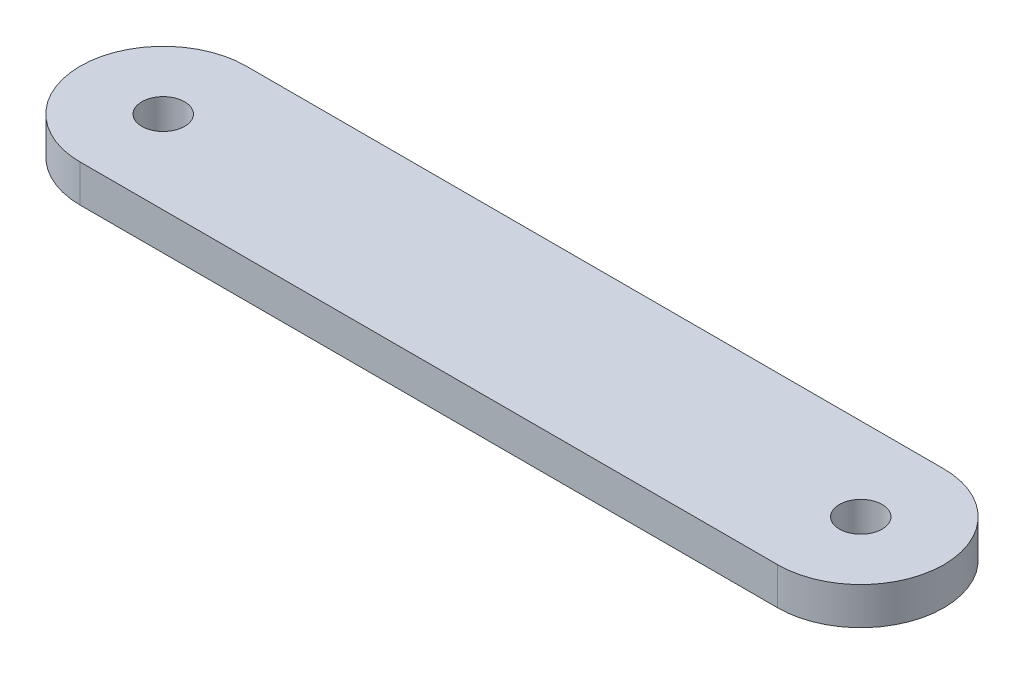
from build123d import *

# Parameters (mm, degrees)
BOSS_EXTRUDE1_DEPTH  = 4.5
SKETCH3_R            = 2.575
F_5_15MM_HOLES_DEPTH = 54.143673189


with BuildPart() as part:
    # Sketch2 → Boss-Extrude1 (new body)
    with BuildSketch(Plane(origin=(0, 0, 0), x_dir=(1, 0, 0), z_dir=(0, 1, 0))):
        with BuildLine():
            Line((42, 10), (-42, 10))
            ThreePointArc((-42, 10), (-52, 0), (-42, -10))
            Line((-42, -10), (42, -10))
            ThreePointArc((42, -10), (52, 0), (42, 10))
        make_face()
    extrude(amount=BOSS_EXTRUDE1_DEPTH)

    # Sketch3 → 5.15mm holes (cut, through all)
    with BuildSketch(Plane(origin=(0, 4.5, 0), x_dir=(1, 0, 0), z_dir=(0, 1, 0))):
        with Locations(Location((42, 0, 0), (0, 0, 270))):
            Circle(SKETCH3_R)
        with Locations(Location((-42, 0, 0), (0, 0, 270))):
            Circle(SKETCH3_R)
    extrude(amount=-F_5_15MM_HOLES_DEPTH, mode=Mode.SUBTRACT)


solid = part.part
